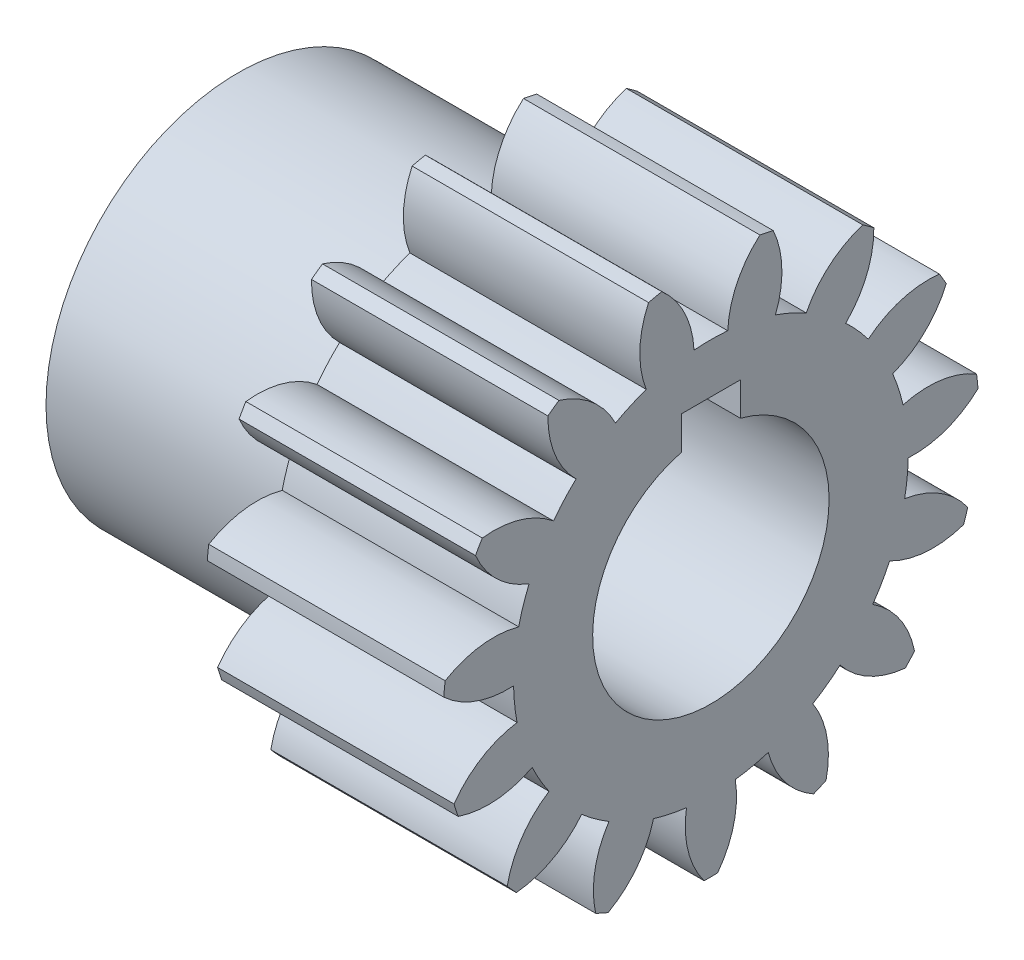
from build123d import *

# Parameters (mm, degrees)
BASPROSKE_W      = 9.525
BASPROSKE_H      = 10.795
TOOTHCUT_DEPTH   = 18.99415669
TEETHCUTS_COUNT  = 15
TEETHCUTS_ANGLE  = 336
HUBNEAONESKE_R   = 7.7343
HUBNEARONE_DEPTH = 9.5250508
BORSKE_R         = 4.7625
BORE_DEPTH       = 19.0500508
KEYSKE_W         = 2.38252
KEYSKE_H         = 5.95376
KEYWAY_DEPTH     = 19.0500508


with BuildPart() as part:
    # BasProSke → Base-Revolve (revolve)
    with BuildSketch(Plane(origin=(0, 0, 0), x_dir=(1, 0, 0), z_dir=(0, 1, 0)), mode=Mode.PRIVATE) as base_revolve_sk:
        with Locations((4.7625, 5.3975)):
            Rectangle(BASPROSKE_W, BASPROSKE_H)
    revolve(base_revolve_sk.sketch.rotate(Axis((-10, 0, 0), (1, 0, 0)), 180), axis=Axis((-10, 0, 0), (1, 0, 0)))

    # TooCutSke → ToothCut (cut, through all)
    with BuildSketch(Plane(origin=(0, 0, 0), x_dir=(0, 0, -1), z_dir=(1, 0, 0))):
        with BuildLine():
            ThreePointArc((0.679427218, 7.921114738), (0, 7.9502), (-0.679427218, 7.921114738))
            ThreePointArc((-0.679427218, 7.921114738), (-1.060032028, 9.413841931), (-2.000613584, 10.633842271))
            ThreePointArc((-2.000613584, 10.633842271), (0, 10.8204), (2.000613584, 10.633842271))
            ThreePointArc((2.000613584, 10.633842271), (1.060032028, 9.413841931), (0.679427218, 7.921114738))
        make_face()
    toothcut = extrude(amount=TOOTHCUT_DEPTH, mode=Mode.SUBTRACT)

    # TeethCuts: ToothCut ×15 about axis
    teethcuts_axis = Axis((-10, 0, 0), (1, 0, 0))
    for i in range(1, TEETHCUTS_COUNT):
        add(toothcut.rotate(teethcuts_axis, i * TEETHCUTS_ANGLE / (TEETHCUTS_COUNT - 1)), mode=Mode.SUBTRACT)

    # HubNeaOneSke → HubNearOne (add)
    with BuildSketch(Plane.ZY):
        with Locations(Location((0, 0, 0), (0, 0, 180))):
            Circle(HUBNEAONESKE_R)
    extrude(amount=HUBNEARONE_DEPTH)

    # BorSke → Bore (cut, symmetric)
    with BuildSketch(Plane(origin=(0, 0, 0), x_dir=(0, 0, -1), z_dir=(1, 0, 0))):
        with Locations(Location((0, 0, 0), (0, 0, 180))):
            Circle(BORSKE_R)
    extrude(amount=BORE_DEPTH, both=True, mode=Mode.SUBTRACT)

    # KeySke → Keyway (cut, symmetric)
    with BuildSketch(Plane(origin=(0, 0, 0), x_dir=(0, 0, -1), z_dir=(1, 0, 0))):
        with Locations((0, 2.97688)):
            Rectangle(KEYSKE_W, KEYSKE_H)
    extrude(amount=KEYWAY_DEPTH, both=True, mode=Mode.SUBTRACT)


solid = part.part
